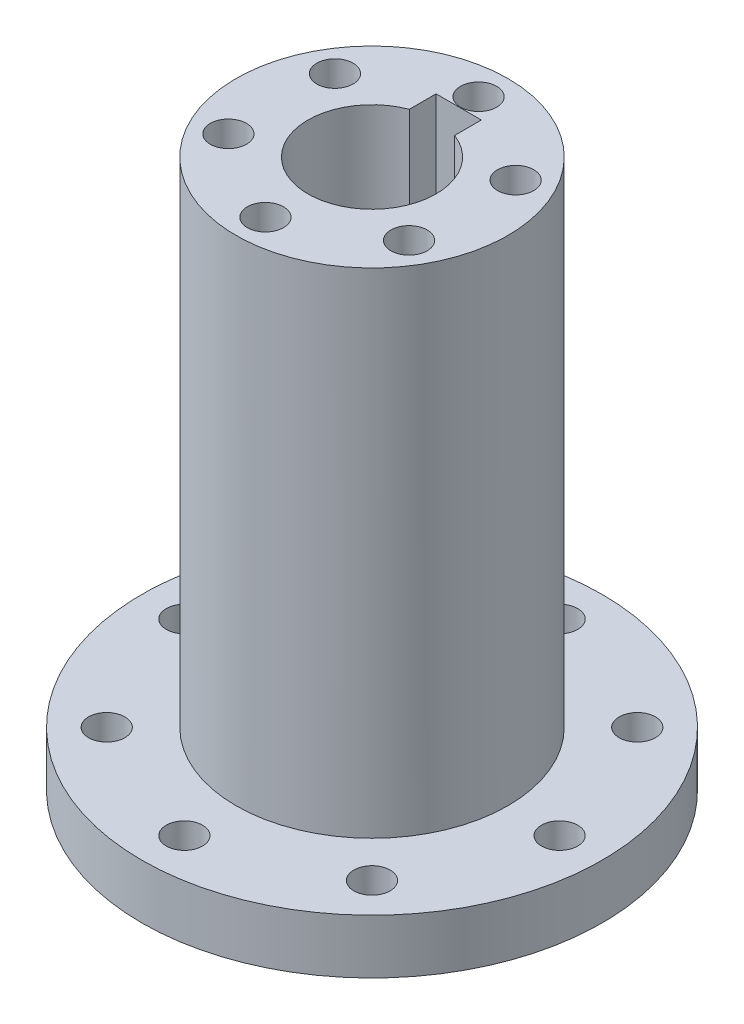
from build123d import *

# Parameters (mm, degrees)
SKETCH2_R             = 25.4
BOSS_EXTRUDE2_DEPTH   = 6
SKETCH3_R             = 15
BOSS_EXTRUDE3_DEPTH   = 60.5
SKETCH4_R             = 10.315
CUT_EXTRUDE1_DEPTH    = 38.1
SKETCH5_R             = 7.07
CUT_EXTRUDE2_DEPTH    = 53.363441445
F_4_0MM_DOWEL_HOLE1_D = 4
CIRPATTERN1_COUNT     = 8
CIRPATTERN2_COUNT     = 6
CUT_EXTRUDE3_REACH    = 72.36


with BuildPart() as part:
    # Sketch2 → Boss-Extrude2 (new body)
    with BuildSketch(Plane(origin=(0, 0, 0), x_dir=(1, 0, 0), z_dir=(0, 1, 0))):
        with Locations(Location((0, 0, 0), (0, 0, 270))):
            Circle(SKETCH2_R)
    extrude(amount=BOSS_EXTRUDE2_DEPTH)

    # Sketch3 → Boss-Extrude3 (add)
    with BuildSketch(Plane.XZ):
        with Locations(Location((0, 0, 0), (0, 0, 270))):
            Circle(SKETCH3_R)
    extrude(amount=-BOSS_EXTRUDE3_DEPTH)

    # Sketch4 → Cut-Extrude1 (cut)
    with BuildSketch(Plane.XZ):
        with Locations(Location((0, 0, 0), (0, 0, 270))):
            Circle(SKETCH4_R)
    extrude(amount=-CUT_EXTRUDE1_DEPTH, mode=Mode.SUBTRACT)

    # Sketch5 → Cut-Extrude2 (cut, through all)
    with BuildSketch(Plane.XZ.offset(-38.1)):
        with Locations(Location((0, 0, 0), (0, 0, 270))):
            Circle(SKETCH5_R)
    extrude(amount=-CUT_EXTRUDE2_DEPTH, mode=Mode.SUBTRACT)

    # Ø4.0mm Dowel Hole1 (through all)
    with Locations(Plane(origin=(0, 0, 0), x_dir=(-1, 0, 0), z_dir=(0, -1, 0))):
        with Locations((0, 20.7)):
            f_4_0mm_dowel_hole1 = Hole(F_4_0MM_DOWEL_HOLE1_D / 2)

    # CirPattern1: Ø4.0mm Dowel Hole1 ×8 about axis
    cirpattern1_axis = Axis((0, 0, 0), (0, 1, 0))
    for i in range(1, CIRPATTERN1_COUNT):
        add(f_4_0mm_dowel_hole1.rotate(cirpattern1_axis, i * 360 / CIRPATTERN1_COUNT), mode=Mode.SUBTRACT)

    # Sketch13 → Ø3.0mm Dowel Hole1 (revolve, cut)
    with BuildSketch(Plane(origin=(-10.14, 60.5, 5.71), x_dir=(0, 0, 1), z_dir=(1, 0, 0))):
        Polygon((0, 0), (0, 6.201721238), (2, 5), (2, 0), align=None)
    f_3_0mm_dowel_hole1 = revolve(axis=Axis((-10.14, 66.85, 5.71), (0, -1, 0)), mode=Mode.SUBTRACT)

    # CirPattern2: Ø3.0mm Dowel Hole1 ×6 about axis
    cirpattern2_axis = Axis((0, 0, 0), (0, 1, 0))
    for i in range(1, CIRPATTERN2_COUNT):
        add(f_3_0mm_dowel_hole1.rotate(cirpattern2_axis, i * 360 / CIRPATTERN2_COUNT), mode=Mode.SUBTRACT)

    # Sketch14 → Cut-Extrude3 (cut, up to next)
    with BuildSketch(Plane(origin=(0, 60.5, 0), x_dir=(1, 0, 0), z_dir=(0, 1, 0)), mode=Mode.PRIVATE) as cut_extrude3_sk1:
        with BuildLine():
            Line((-2.5, 9.57), (2.5, 9.57))
            Line((2.5, 9.57), (2.5, 6.613236726))
            ThreePointArc((2.5, 6.613236726), (0, 7.07), (-2.5, 6.613236726))
            Line((-2.5, 6.613236726), (-2.5, 9.57))
        make_face()
    cut_extrude3_tool1 = extrude(cut_extrude3_sk1.sketch, amount=-CUT_EXTRUDE3_REACH, mode=Mode.PRIVATE) & part.part
    add(cut_extrude3_tool1.solids().sort_by_distance((0, 60.5, -8.24142))[0], mode=Mode.SUBTRACT)


solid = part.part
